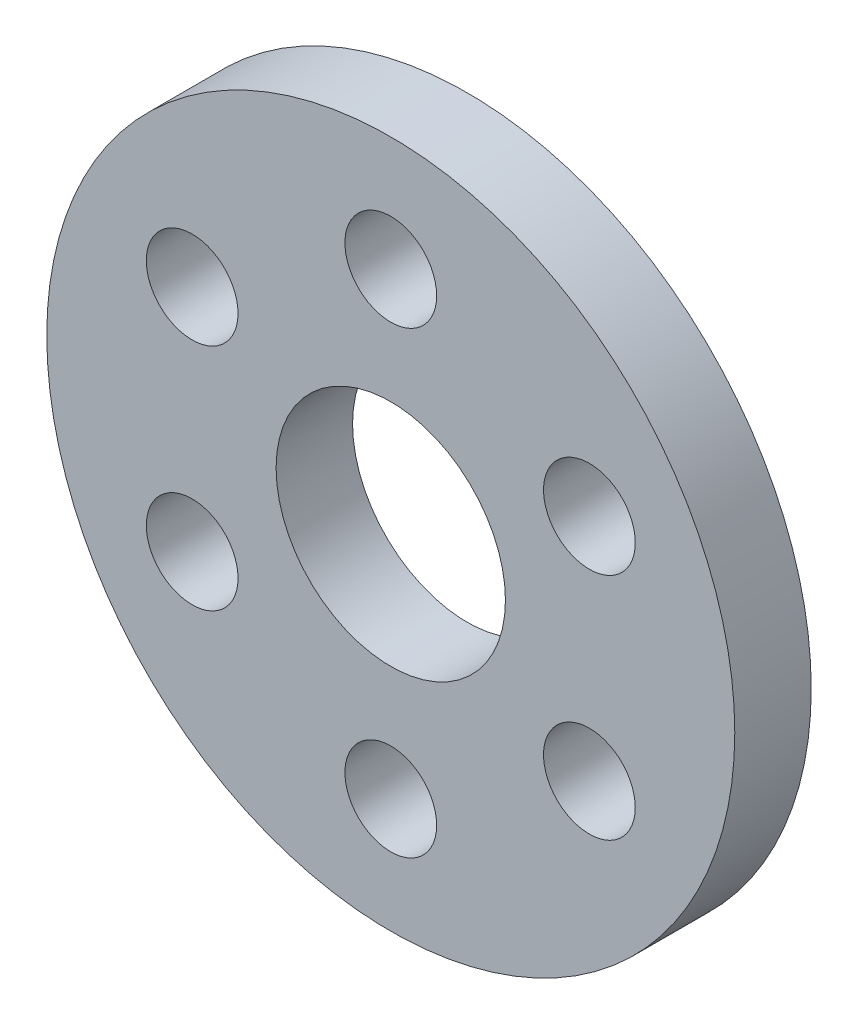
from build123d import *

# Parameters (mm, degrees)
SKETCH1_R           = 67.5
SKETCH1_R_2         = 22.5
SKETCH1_R_3         = 9
BOSS_EXTRUDE1_DEPTH = 15


with BuildPart() as part:
    # Sketch1 → Boss-Extrude1 (new body)
    with BuildSketch(Plane.XY):
        Circle(SKETCH1_R)
        Circle(SKETCH1_R_2, mode=Mode.SUBTRACT)
        with Locations((0, -45)):
            Circle(SKETCH1_R_3, mode=Mode.SUBTRACT)
        with Locations((38.97114317, -22.5)):
            Circle(SKETCH1_R_3, mode=Mode.SUBTRACT)
        with Locations((38.97114317, 22.5)):
            Circle(SKETCH1_R_3, mode=Mode.SUBTRACT)
        with Locations((0, 45)):
            Circle(SKETCH1_R_3, mode=Mode.SUBTRACT)
        with Locations((-38.97114317, 22.5)):
            Circle(SKETCH1_R_3, mode=Mode.SUBTRACT)
        with Locations((-38.97114317, -22.5)):
            Circle(SKETCH1_R_3, mode=Mode.SUBTRACT)
    extrude(amount=BOSS_EXTRUDE1_DEPTH)


solid = part.part
